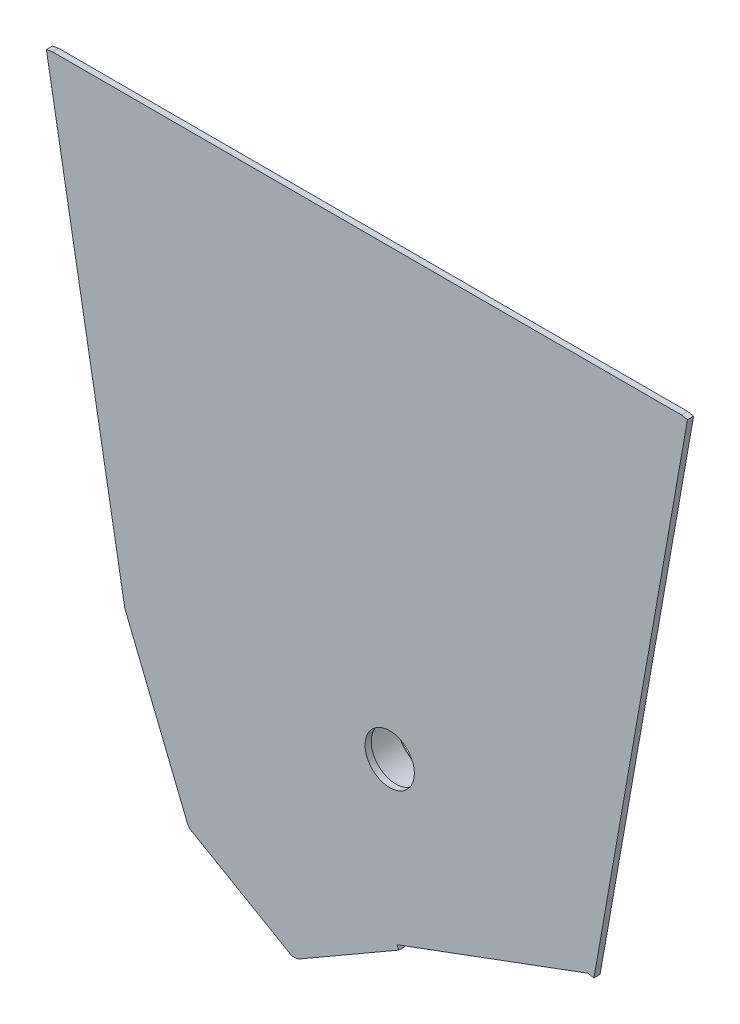
from build123d import *

# Parameters (mm, degrees)
SZKIC1_R                    = 20
DODANIE_WYCI_GNI_CIE1_DEPTH = 5
SZKIC2_R                    = 35
SZKIC2_R_2                  = 30
DODANIE_WYCI_GNI_CIE2_DEPTH = 30
ZAOKR_GLENIE1_R             = 3
SFAZOWANIE1_SIZE            = 1
WYTNIJ_WYCI_GNI_CIE1_REACH  = 377.661
SZKIC3_W                    = 40
SZKIC3_H                    = 30


with BuildPart() as part:
    # Szkic1 → Dodanie-wyciągnięcie1 (new body)
    with BuildSketch(Plane.XY):
        with BuildLine():
            Line((184.10343706, -161.91555121), (259.924038765, 268.08444879))
            Line((259.924038765, 268.08444879), (255, 268.952689679))
            Line((255, 268.952689679), (-255, 268.952689679))
            Line((-255, 268.952689679), (-259.924038765, 268.08444879))
            Line((-259.924038765, 268.08444879), (-196.501079187, -91.605028812))
            ThreePointArc((-196.501079187, -91.605028812), (-196.31271073, -92.420942238), (-196.040087999, -93.212696138))
            Line((-196.040087999, -93.212696138), (-145.637863945, -217.962578277))
            ThreePointArc((-145.637863945, -217.962578277), (-144.258069751, -220.214197762), (-142.220393109, -221.89392876))
            Line((-142.220393109, -221.89392876), (-62.568634717, -267.880892909))
            ThreePointArc((-62.568634717, -267.880892909), (-58.568634717, -268.952689679), (-54.568634717, -267.880892909))
            Line((-54.568634717, -267.880892909), (25.977713055, -221.37743734))
            Line((25.977713055, -221.37743734), (24.300392396, -218.442734314))
            Line((24.300392396, -218.442734314), (179.179398295, -161.047310321))
            Line((179.179398295, -161.047310321), (184.10343706, -161.91555121))
        make_face()
        with Locations((18.477713055, -91.047310321)):
            Circle(SZKIC1_R, mode=Mode.SUBTRACT)
    extrude(amount=DODANIE_WYCI_GNI_CIE1_DEPTH)

    # Szkic2 → Dodanie-wyciągnięcie2 (add)
    with BuildSketch(Plane(origin=(0, 0, 0), x_dir=(-1, 0, 0), z_dir=(0, 0, -1))):
        with Locations(Location((-18.477713055, -91.047310321, 0), (0, 0, 180))):
            Circle(SZKIC2_R)
        with Locations((-18.477713055, -91.047310321)):
            Circle(SZKIC2_R_2, mode=Mode.SUBTRACT)
    extrude(amount=DODANIE_WYCI_GNI_CIE2_DEPTH)

    # Zaokrąglenie1
    zaokr_glenie1_edges = [part.edges().sort_by_distance(p)[0] for p in [
        (-16.522286945, -91.047310321, 0),
        (48.477713055, -91.047310321, 0),
    ]]
    fillet(zaokr_glenie1_edges, radius=ZAOKR_GLENIE1_R)

    # Sfazowanie1
    sfazowanie1_edges = [part.edges().sort_by_distance(p)[0] for p in [
        (48.477713055, -91.047310321, -30),
    ]]
    chamfer(sfazowanie1_edges, length=SFAZOWANIE1_SIZE)

    # Wytnij-wyciągnięcie1: up to this face of the body (flat: up to its plane)
    wytnij_wyci_gni_cie1_end = Plane(part.part.faces().sort_by_distance((-2.974035495, 45.126885672, 0))[0])
    # Szkic3 → Wytnij-wyciągnięcie1 (cut, up to the picked face)
    with BuildSketch(Plane(origin=(0, 0, -30), x_dir=(-1, 0, 0), z_dir=(0, 0, -1)), mode=Mode.PRIVATE) as wytnij_wyci_gni_cie1_sk1:
        with Locations((-18.477713055, -60.047310321)):
            Rectangle(SZKIC3_W, SZKIC3_H)
    wytnij_wyci_gni_cie1_tool1 = split(extrude(wytnij_wyci_gni_cie1_sk1.sketch, amount=-WYTNIJ_WYCI_GNI_CIE1_REACH, mode=Mode.PRIVATE), bisect_by=wytnij_wyci_gni_cie1_end, keep=Keep.BOTH, mode=Mode.PRIVATE)
    add(wytnij_wyci_gni_cie1_tool1.solids().sort_by(Axis((18.477713, -60.04731, -30), (0, 0, 1)))[0], mode=Mode.SUBTRACT)


solid = part.part
